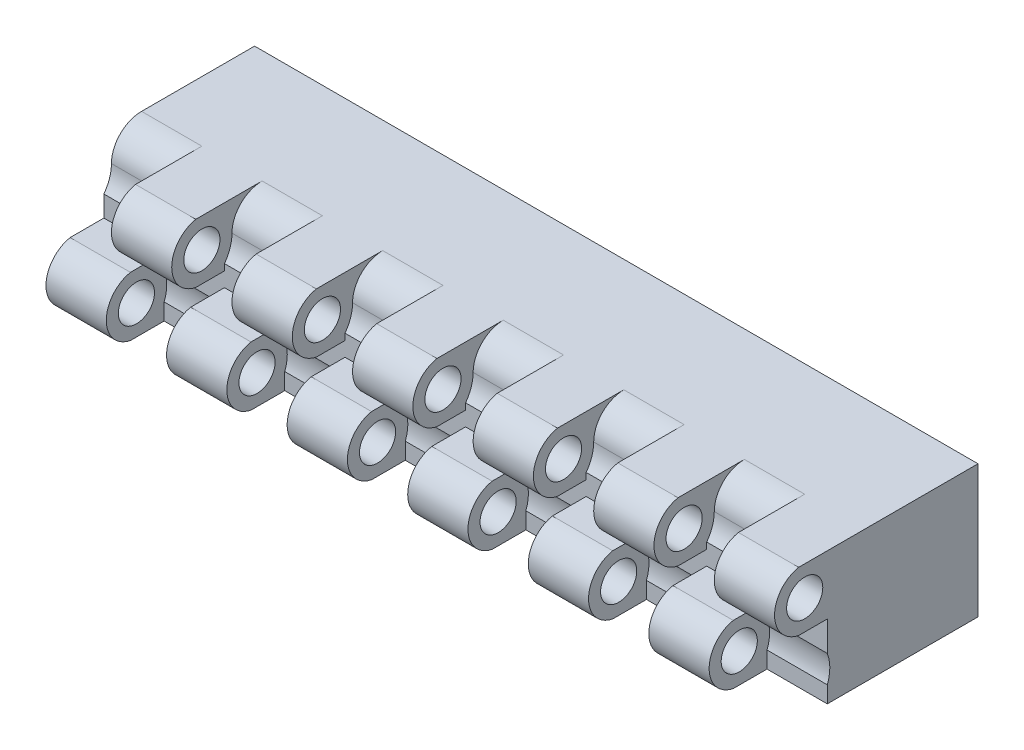
from build123d import *

# Parameters (mm, degrees)
SKETCH1_W           = 25
SKETCH1_H           = 22
BOSS_EXTRUDE1_DEPTH = 60
CUT_EXTRUDE2_REACH  = 123.15
CUT_EXTRUDE3_REACH  = 123.15
SKETCH6_R           = 6.26
FILLET1_R           = 5
SKETCH2_R           = 3
BOSS_EXTRUDE2_DEPTH = 10
LPATTERN1_COUNT     = 6
LPATTERN1_PITCH     = 20
SKETCH3_R           = 3
BOSS_EXTRUDE3_DEPTH = 10
LPATTERN2_COUNT     = 6
LPATTERN2_PITCH     = 20
SKETCH9_R           = 7
SKETCH9_W           = 3
SKETCH9_H           = 11
CUT_EXTRUDE5_DEPTH  = 15


with BuildPart() as part:
    # Sketch1 → Boss-Extrude1 (new, symmetric)
    with BuildSketch(Plane(origin=(0, 0, 0), x_dir=(0, 0, -1), z_dir=(1, 0, 0))):
        Rectangle(SKETCH1_W, SKETCH1_H)
    extrude(amount=BOSS_EXTRUDE1_DEPTH, both=True)

    # Sketch5 → Cut-Extrude2 (cut, up to next)
    with BuildSketch(Plane(origin=(60, 0, 0), x_dir=(0, 0, -1), z_dir=(1, 0, 0)), mode=Mode.PRIVATE) as cut_extrude2_sk1:
        with BuildLine():
            Line((-13.743342576, 11), (-11.25, 11))
            Line((-11.25, 11), (-11.25, 6.005))
            ThreePointArc((-11.25, 6.005), (-23.092030441, 3.213639122), (-13.743342576, 11))
        make_face()
    cut_extrude2_tool1 = extrude(cut_extrude2_sk1.sketch, amount=-CUT_EXTRUDE2_REACH, mode=Mode.PRIVATE) & part.part
    add(cut_extrude2_tool1.solids().sort_by_distance((60, 6.117758, 17.335764))[0], mode=Mode.SUBTRACT)

    # Sketch6 → Cut-Extrude3 (cut, up to next)
    with BuildSketch(Plane.ZY.offset(60), mode=Mode.PRIVATE) as cut_extrude3_sk1:
        with Locations((18.339471377, -6)):
            Circle(SKETCH6_R)
    cut_extrude3_tool1 = extrude(cut_extrude3_sk1.sketch, amount=-CUT_EXTRUDE3_REACH, mode=Mode.PRIVATE) & part.part
    add(cut_extrude3_tool1.solids().sort_by_distance((-60, -6, 18.339471))[0], mode=Mode.SUBTRACT)

    # Fillet1
    fillet1_edges = [part.edges().sort_by_distance(p)[0] for p in [
        (0, 11, 11.25),
    ]]
    fillet(fillet1_edges, radius=FILLET1_R)

    # Sketch2 → Boss-Extrude2 (add)
    with BuildSketch(Plane(origin=(60, 0, 0), x_dir=(0, 0, -1), z_dir=(1, 0, 0))):
        with BuildLine():
            Line((-17.250000617, 1.202041029), (-6.000000617, 1.202041029))
            Line((-6.000000617, 1.202041029), (-6.000000617, 11))
            Line((-6.000000617, 11), (-17.250000617, 11))
            ThreePointArc((-17.250000617, 11), (-21.250000617, 6.101020514), (-17.250000617, 1.202041029))
        make_face()
        with Locations((-16.250000617, 6.101020514)):
            Circle(SKETCH2_R, mode=Mode.SUBTRACT)
    boss_extrude2 = extrude(amount=-BOSS_EXTRUDE2_DEPTH)

    # LPattern1: Boss-Extrude2 ×6
    with Locations(*[(-i * LPATTERN1_PITCH, 0, 0) for i in range(1, LPATTERN1_COUNT)]):
        add(boss_extrude2)

    # Sketch3 → Boss-Extrude3 (add)
    with BuildSketch(Plane.ZY.offset(60)):
        with BuildLine():
            Line((18.103250446, -1.202041029), (12.5, -1.202041029))
            Line((12.5, -1.202041029), (12.5, -3.744301875))
            ThreePointArc((12.5, -3.744301875), (12.185501487, -4.85271861), (12.079471377, -6))
            ThreePointArc((12.079471377, -6), (12.185501487, -7.14728139), (12.5, -8.255698125))
            Line((12.5, -8.255698125), (12.5, -11))
            Line((12.5, -11), (18.103250446, -11))
            ThreePointArc((18.103250446, -11), (22.103250446, -6.101020514), (18.103250446, -1.202041029))
        make_face()
        with Locations((17.103250446, -6.101020514)):
            Circle(SKETCH3_R, mode=Mode.SUBTRACT)
    boss_extrude3 = extrude(amount=-BOSS_EXTRUDE3_DEPTH)

    # LPattern2: Boss-Extrude3 ×6
    with Locations(*[(i * LPATTERN2_PITCH, 0, 0) for i in range(1, LPATTERN2_COUNT)]):
        add(boss_extrude3)

    # Sketch9 → Cut-Extrude5 (cut)
    with BuildSketch(Plane(origin=(0, 0, -12.5), x_dir=(-1, 0, 0), z_dir=(0, 0, -1))):
        with Locations(Location((0, 0, 0), (0, 0, 90))):
            Circle(SKETCH9_R)
        with Locations((-14, 0)):
            Rectangle(SKETCH9_W, SKETCH9_H)
        with Locations((14, 0)):
            Rectangle(SKETCH9_W, SKETCH9_H)
    extrude(amount=-CUT_EXTRUDE5_DEPTH, mode=Mode.SUBTRACT)


solid = part.part
